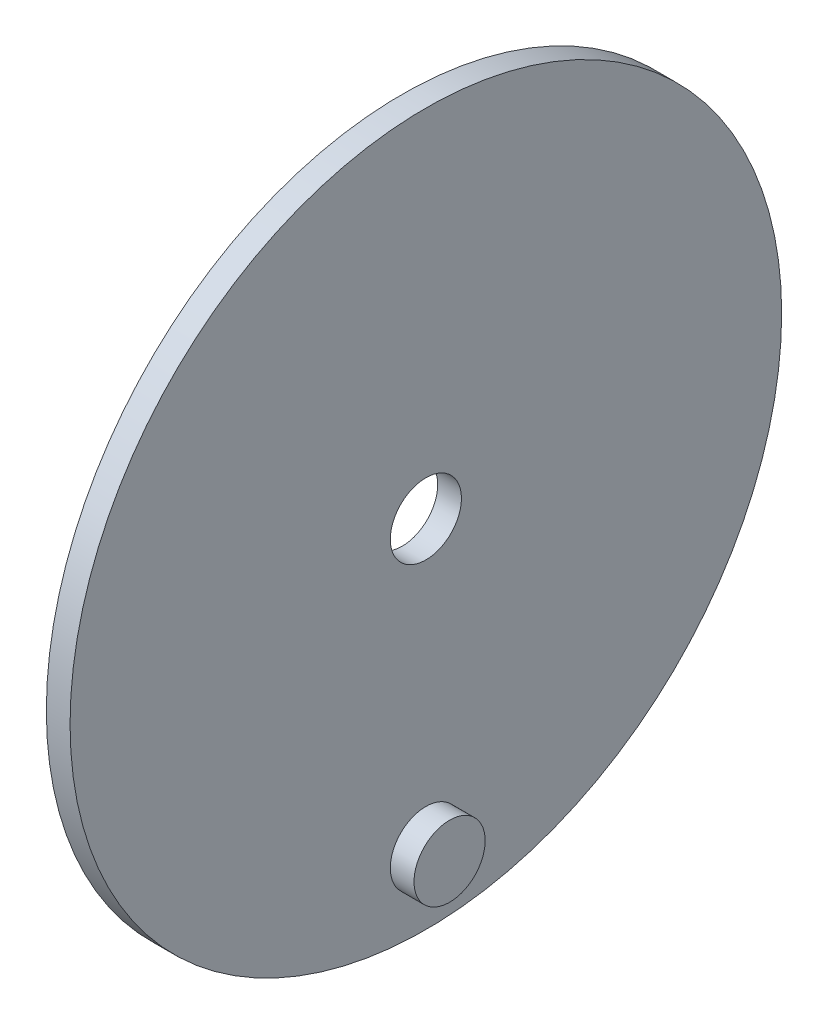
from build123d import *

# Parameters (mm, degrees)
SKETCH1_R           = 150
SKETCH1_R_2         = 15
BOSS_EXTRUDE1_DEPTH = 10
SKETCH2_R           = 15
BOSS_EXTRUDE2_DEPTH = 10


with BuildPart() as part:
    # Sketch1 → Boss-Extrude1 (new body)
    with BuildSketch(Plane(origin=(0, 0, 0), x_dir=(0, 0, -1), z_dir=(1, 0, 0))):
        Circle(SKETCH1_R)
        Circle(SKETCH1_R_2, mode=Mode.SUBTRACT)
    extrude(amount=BOSS_EXTRUDE1_DEPTH)

    # Sketch2 → Boss-Extrude2 (add)
    with BuildSketch(Plane(origin=(10, 0, 0), x_dir=(0, 0, -1), z_dir=(1, 0, 0))):
        with Locations((0, -120)):
            Circle(SKETCH2_R)
    extrude(amount=BOSS_EXTRUDE2_DEPTH)


solid = part.part
